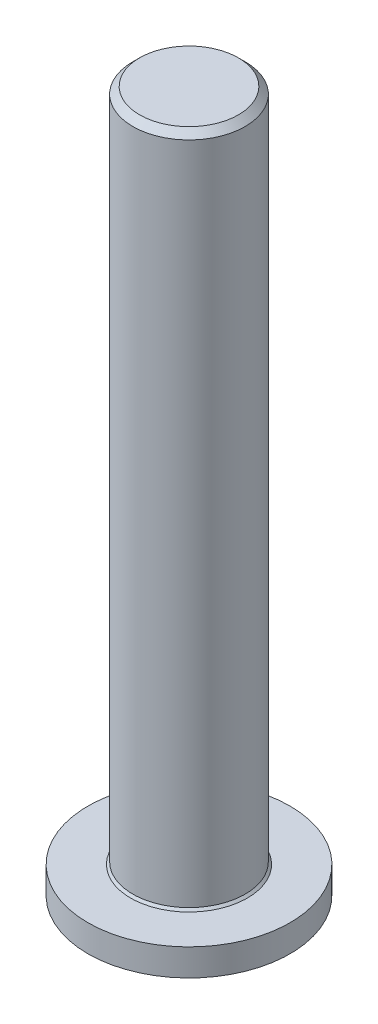
from build123d import *

# Parameters (mm, degrees)
SKETCH2_R           = 4.5
BOSS_EXTRUDE1_DEPTH = 1.5
SKETCH3_R           = 2.5
BOSS_EXTRUDE2_DEPTH = 30
CHAMFER1_SIZE       = 0.1
CHAMFER2_SIZE       = 0.75
CHAMFER2_SIZE2      = 0.3
CUT_EXTRUDE1_DEPTH  = 3
CHAMFER3_SIZE       = 0.3


with BuildPart() as part:
    # Sketch2 → Boss-Extrude1 (new body)
    with BuildSketch(Plane(origin=(0, 0, 0), x_dir=(1, 0, 0), z_dir=(0, 1, 0))):
        with Locations(Location((0, 0, 0), (0, 0, 270))):
            Circle(SKETCH2_R)
    extrude(amount=BOSS_EXTRUDE1_DEPTH)

    # Sketch3 → Boss-Extrude2 (add)
    with BuildSketch(Plane(origin=(0, 1.5, 0), x_dir=(1, 0, 0), z_dir=(0, 1, 0))):
        with Locations(Location((0, 0, 0), (0, 0, 270))):
            Circle(SKETCH3_R)
    extrude(amount=BOSS_EXTRUDE2_DEPTH)

    # Chamfer1
    chamfer1_edges = [part.edges().sort_by_distance(p)[0] for p in [
        (0, 1.5, -2.5),
    ]]
    chamfer(chamfer1_edges, length=CHAMFER1_SIZE)

    # Chamfer2
    chamfer2_edges = [part.edges().sort_by_distance(p)[0] for p in [
        (0, 0, -4.5),
    ]]
    chamfer2_side = [part.faces().sort_by_distance(p)[0] for p in [
        (0, 0, 0),
    ]]
    chamfer(chamfer2_edges, length=CHAMFER2_SIZE, length2=CHAMFER2_SIZE2, reference=chamfer2_side[0])

    # Sketch4 → Cut-Extrude1 (cut)
    with BuildSketch(Plane.XZ):
        Polygon((-0.422737578, 1.679670486), (-1.6660061, 0.473733761), (-1.243268521, -1.205936725), (0.422737578, -1.679670486), (1.6660061, -0.473733761), (1.243268521, 1.205936725), align=None)
    extrude(amount=-CUT_EXTRUDE1_DEPTH, mode=Mode.SUBTRACT)

    # Chamfer3
    chamfer3_edges = [part.edges().sort_by_distance(p)[0] for p in [
        (0, 31.5, -2.5),
    ]]
    chamfer(chamfer3_edges, length=CHAMFER3_SIZE)


solid = part.part
